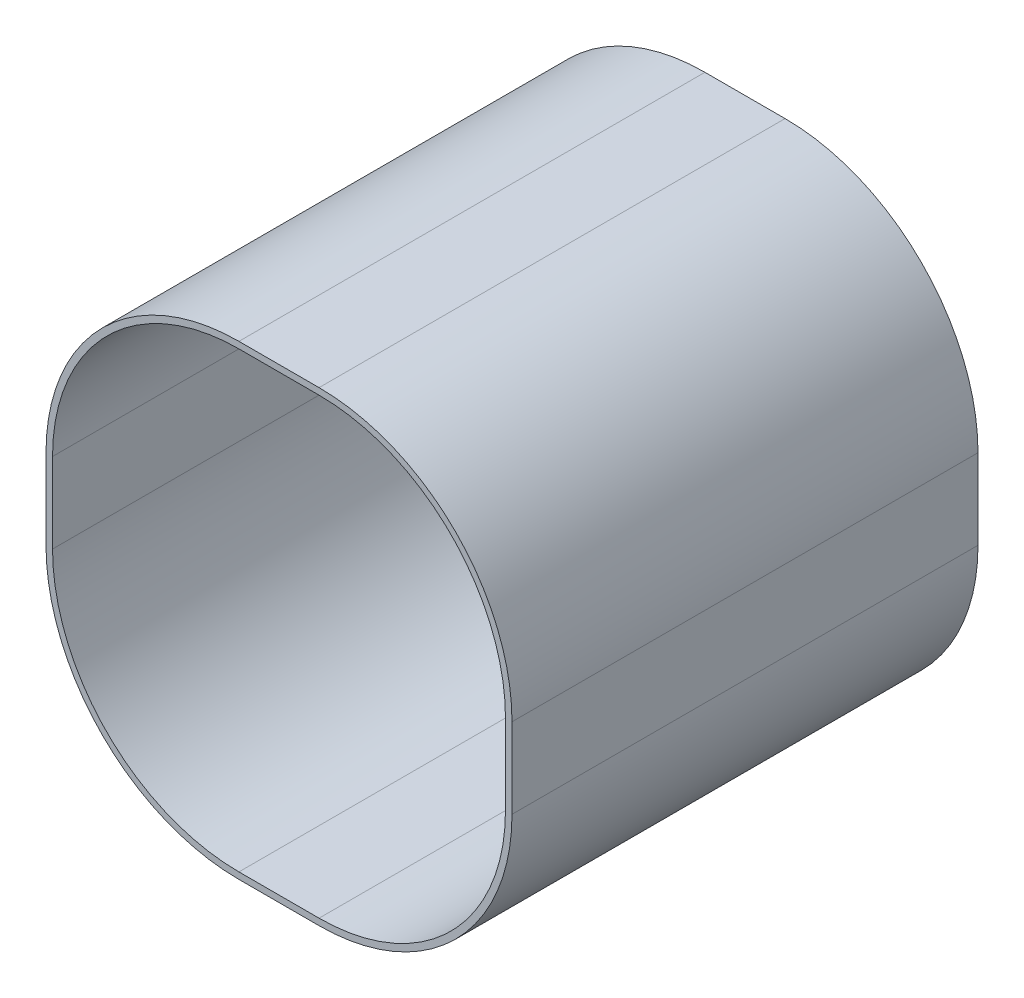
from build123d import *

# Parameters (mm, degrees)
SKETCH1_W           = 25
SKETCH1_H           = 25
SKETCH1_W_2         = 24.3
SKETCH1_H_2         = 24.3
BOSS_EXTRUDE1_DEPTH = 25
FILLET3_R           = 10
FILLET4_R           = 10.35


with BuildPart() as part:
    # Sketch1 → Boss-Extrude1 (new body)
    with BuildSketch(Plane.XY):
        Rectangle(SKETCH1_W, SKETCH1_H)
        Rectangle(SKETCH1_W_2, SKETCH1_H_2, mode=Mode.SUBTRACT)
    extrude(amount=BOSS_EXTRUDE1_DEPTH)

    # Fillet3
    fillet3_edges = [part.edges().sort_by_distance(p)[0] for p in [
        (12.15, -12.15, 12.5),
        (12.15, 12.15, 12.5),
        (-12.15, 12.15, 12.5),
        (-12.15, -12.15, 12.5),
    ]]
    fillet(fillet3_edges, radius=FILLET3_R)

    # Fillet4
    fillet4_edges = [part.edges().sort_by_distance(p)[0] for p in [
        (12.5, -12.5, 12.5),
        (-12.5, -12.5, 12.5),
        (-12.5, 12.5, 12.5),
        (12.5, 12.5, 12.5),
    ]]
    fillet(fillet4_edges, radius=FILLET4_R)


solid = part.part
